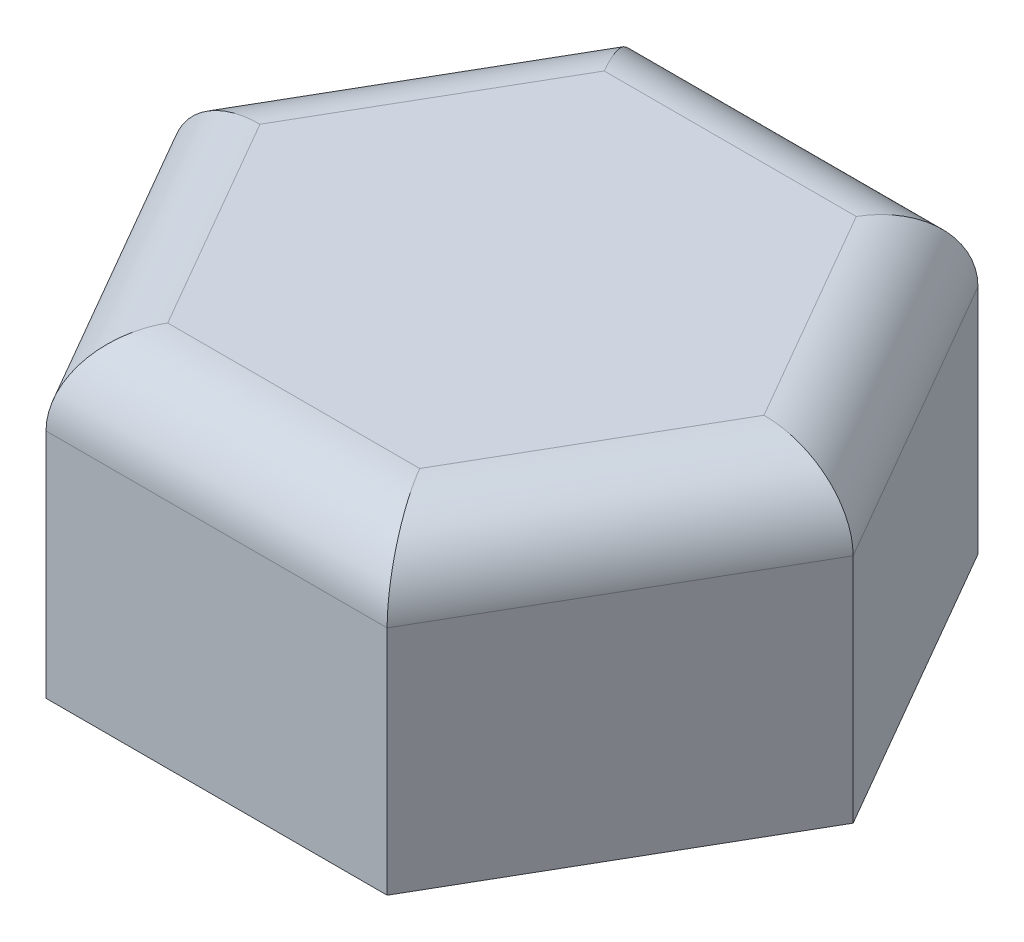
from build123d import *

# Parameters (mm, degrees)
SKETCH1_R           = 2.4
BOSS_EXTRUDE1_DEPTH = 4
FILLET1_R           = 1
BOSS_EXTRUDE4_START = -3
SKETCH2_R           = 2.4
BOSS_EXTRUDE4_DEPTH = 3


with BuildPart() as part:
    # Sketch1 → Boss-Extrude1 (new body)
    with BuildSketch(Plane(origin=(0, 0, 0), x_dir=(1, 0, 0), z_dir=(0, 1, 0))):
        Polygon((-4.419962439, 0), (-2.20998122, -3.827799756), (2.20998122, -3.827799756), (4.419962439, 0), (2.20998122, 3.827799756), (-2.20998122, 3.827799756), align=None)
        with Locations(Location((0, 0, 0), (0, 0, 270))):
            Circle(SKETCH1_R, mode=Mode.SUBTRACT)
    extrude(amount=BOSS_EXTRUDE1_DEPTH)

    # Fillet1
    fillet1_edges = [part.edges().sort_by_distance(p)[0] for p in [
        (0, 4, 3.827799756),
        (3.31497183, 4, 1.913899878),
        (3.31497183, 4, -1.913899878),
        (0, 4, -3.827799756),
        (-3.31497183, 4, -1.913899878),
        (-3.31497183, 4, 1.913899878),
    ]]
    fillet(fillet1_edges, radius=FILLET1_R)

    # Sketch2 → Boss-Extrude4 (add)
    with BuildSketch(Plane(origin=(0, 4, 0), x_dir=(1, 0, 0), z_dir=(0, 1, 0)).offset(BOSS_EXTRUDE4_START)):
        with Locations(Location((0, 0, 0), (0, 0, 270))):
            Circle(SKETCH2_R)
    extrude(amount=BOSS_EXTRUDE4_DEPTH)


solid = part.part
